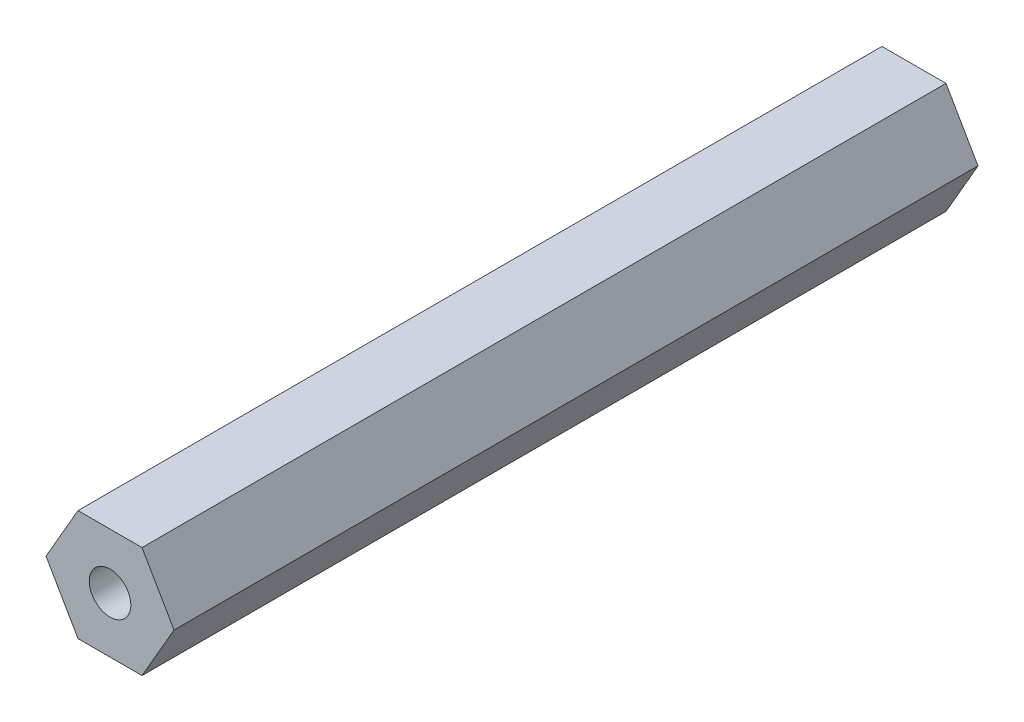
from build123d import *

# Parameters (mm, degrees)
CROQUIS1_R              = 1.5
SALIENTE_EXTRUIR1_DEPTH = 29


with BuildPart() as part:
    # Croquis1 → Saliente-Extruir1 (new, symmetric)
    with BuildSketch(Plane.XY):
        Polygon((4.618802154, 0), (2.309401077, 4), (-2.309401077, 4), (-4.618802154, 0), (-2.309401077, -4), (2.309401077, -4), align=None)
        with Locations(Location((0, 0, 0), (0, 0, 180))):
            Circle(CROQUIS1_R, mode=Mode.SUBTRACT)
    extrude(amount=SALIENTE_EXTRUIR1_DEPTH, both=True)


solid = part.part
